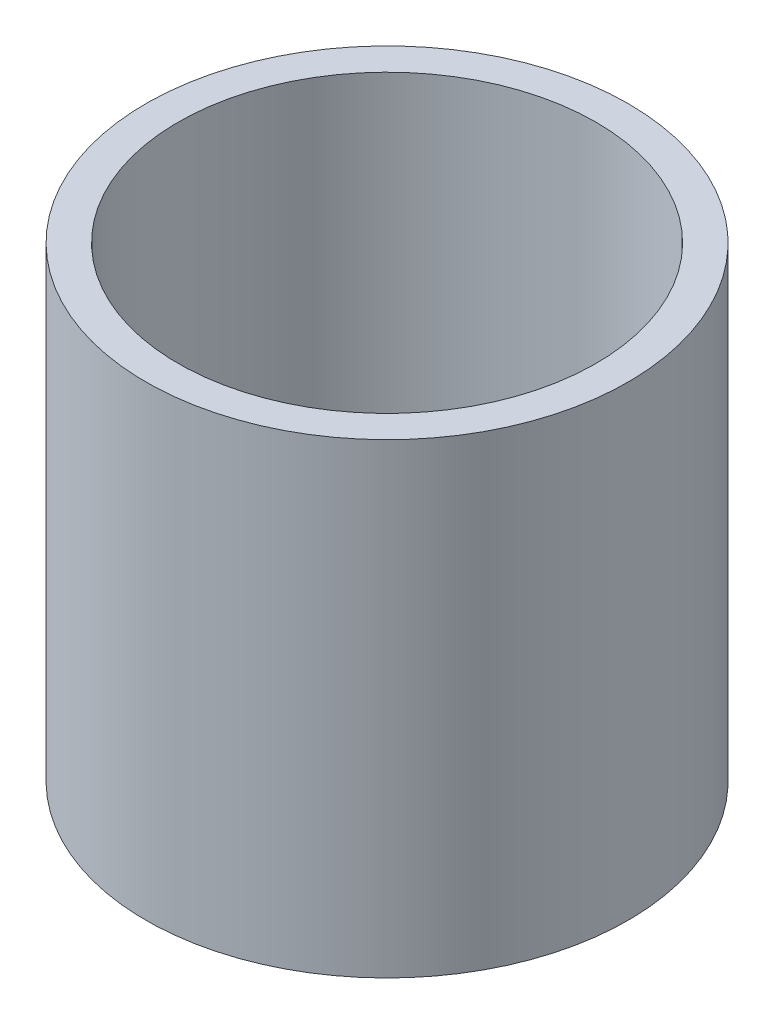
from build123d import *


with BuildPart() as part:
    # Sketch1 → Revolve1 (revolve)
    with BuildSketch(Plane.XY, mode=Mode.PRIVATE) as revolve1_sk:
        with BuildLine():
            Line((0, 0), (0, 0.8))
            Line((0, 0.8), (1.8, 0.8))
            ThreePointArc((1.8, 0.8), (2.365685425, 1.034314575), (2.6, 1.6))
            Line((2.6, 1.6), (2.6, 5.8))
            Line((2.6, 5.8), (3, 5.8))
            Line((3, 5.8), (3, 0))
            Line((3, 0), (0, 0))
        make_face()
    revolve(revolve1_sk.sketch.rotate(Axis((0, 0, 0), (0, 1, 0)), 90), axis=Axis((0, 0, 0), (0, 1, 0)))


solid = part.part
